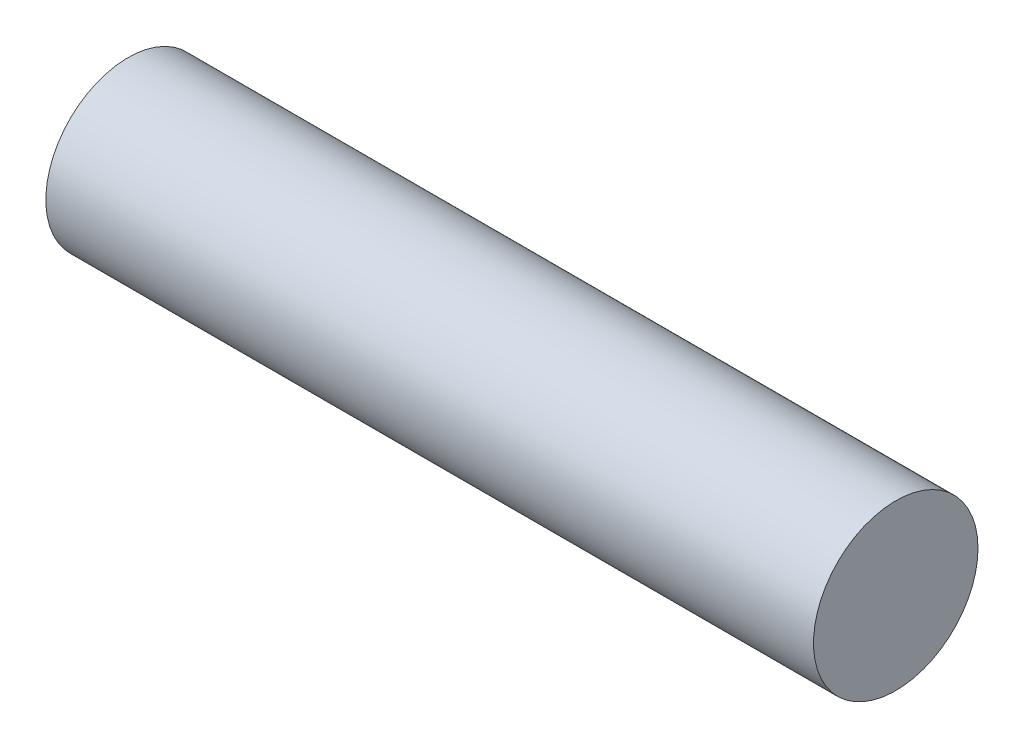
from build123d import *

# Parameters (mm, degrees)
SKETCH1_R           = 1.5
BOSS_EXTRUDE1_DEPTH = 14


with BuildPart() as part:
    # Sketch1 → Boss-Extrude1 (new body)
    with BuildSketch(Plane(origin=(0, 0, 0), x_dir=(0, 0, -1), z_dir=(1, 0, 0))):
        Circle(SKETCH1_R)
    extrude(amount=BOSS_EXTRUDE1_DEPTH)


solid = part.part
